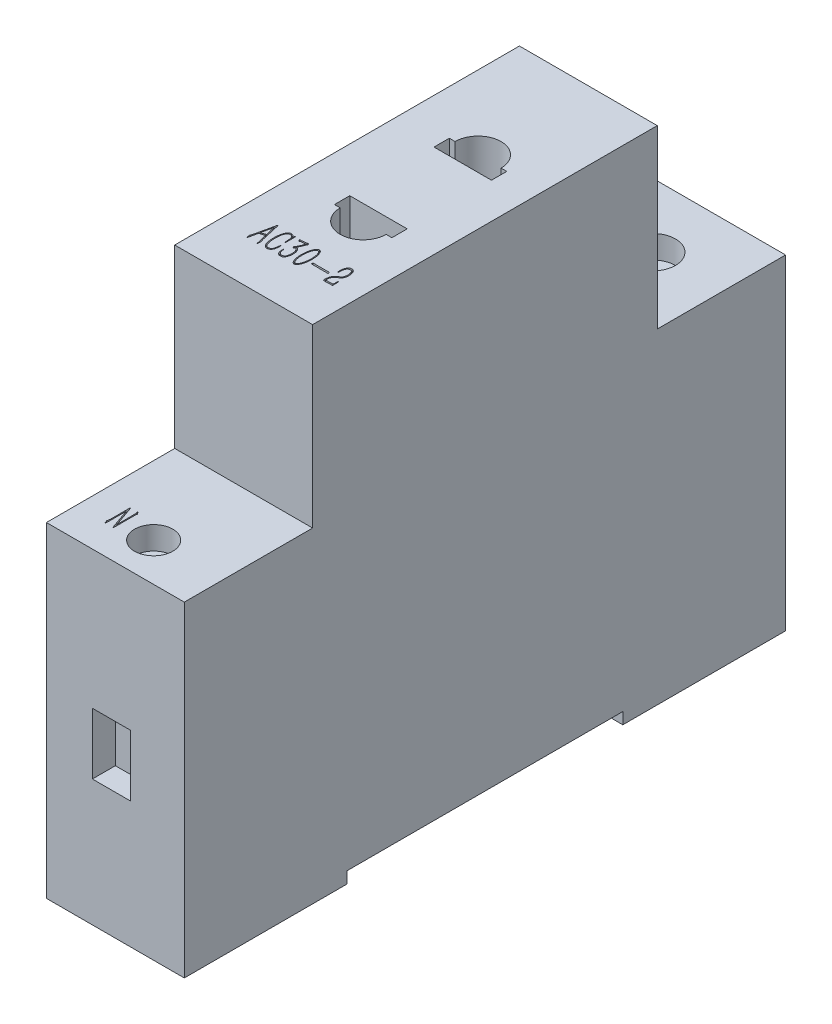
from build123d import *

# Parameters (mm, degrees)
EXTRUDE_1_DEPTH     = 9
SKETCH_2_R          = 2.5
CUT_EXTRUDE_1_DEPTH = 3
SKETCH_3_W          = 5
SKETCH_3_H          = 8
CUT_EXTRUDE_2_DEPTH = 3
SKETCH_5_R          = 3
CUT_EXTRUDE_3_DEPTH = 3
SKETCH_6_W          = 5
SKETCH_6_H          = 8
CUT_EXTRUDE_4_DEPTH = 3
SKETCH_9_W          = 2.164287236
SKETCH_9_H          = 0.217025357
CUT_EXTRUDE_6_DEPTH = 0.3
CUT_EXTRUDE_7_DEPTH = 0.3
CUT_EXTRUDE_9_DEPTH = 5


with BuildPart() as part:
    # 草图1 → 凸台-拉伸1 (new, symmetric)
    with BuildSketch(Plane(origin=(0, 0, 0), x_dir=(0, 0, -1), z_dir=(1, 0, 0))):
        Polygon((-22.5, 32.75), (-22.5, 9.75), (-39.25, 9.75), (-39.25, -32.75), (-22.5, -32.75), (-18, -32.75), (-18, -31.25), (18, -31.25), (18, -32.75), (22.5, -32.75), (39.25, -32.75), (39.25, 9.75), (22.5, 9.75), (22.5, 32.75), align=None)
    extrude(amount=EXTRUDE_1_DEPTH, both=True)

    # 草图2 → 切除-拉伸1 (cut)
    with BuildSketch(Plane(origin=(0, 9.75, 0), x_dir=(1, 0, 0), z_dir=(0, 1, 0))):
        with Locations((0, -34.25)):
            Circle(SKETCH_2_R)
    extrude(amount=-CUT_EXTRUDE_1_DEPTH, mode=Mode.SUBTRACT)

    # 草图3 → 切除-拉伸2 (cut)
    with BuildSketch(Plane.XY.offset(39.25)):
        with Locations((-0.5, -12.25)):
            Rectangle(SKETCH_3_W, SKETCH_3_H)
    extrude(amount=-CUT_EXTRUDE_2_DEPTH, mode=Mode.SUBTRACT)

    # 草图5 → 切除-拉伸3 (cut)
    with BuildSketch(Plane(origin=(0, 9.75, 0), x_dir=(1, 0, 0), z_dir=(0, 1, 0))):
        with Locations((0, 30.875)):
            Circle(SKETCH_5_R)
    extrude(amount=-CUT_EXTRUDE_3_DEPTH, mode=Mode.SUBTRACT)

    # 草图6 → 切除-拉伸4 (cut)
    with BuildSketch(Plane(origin=(0, 0, -39.25), x_dir=(-1, 0, 0), z_dir=(0, 0, -1))):
        with Locations((0.051136376, -12.435750671)):
            Rectangle(SKETCH_6_W, SKETCH_6_H)
    extrude(amount=-CUT_EXTRUDE_4_DEPTH, mode=Mode.SUBTRACT)

    # 草图9 → 切除-拉伸6 (cut)
    # profile 1 of 6: a face of its own
    with BuildSketch(Plane(origin=(0, 32.75, 0), x_dir=(1, 0, 0), z_dir=(0, 1, 0))):
        with BuildLine():
            Line((-4.153846154, -15.517259749), (-4.838482847, -15.682825485))
            Line((-4.838482847, -15.682825485), (-4.999573833, -16.433091839))
            Line((-4.999573833, -16.433091839), (-5.075644577, -16.815682932))
            Line((-5.075644577, -16.815682932), (-5.105476241, -16.936501172))
            add(Edge.make_bspline(
                [(-5.105476241, -16.936501172), (-5.10864397, -16.945059256), (-5.113986048, -16.959491663), (-5.124037779, -16.97647154), (-5.13506828, -16.98490966), (-5.14738396, -16.98668845), (-5.156623365, -16.976009255), (-5.162117538, -16.962475291), (-5.163762051, -16.942614008), (-5.168331734, -16.916755356), (-5.171189485, -16.879763732), (-5.174468618, -16.851712187), (-5.176326444, -16.835819305)],
                knots=[0, 0, 0, 0, 1.226577759, 2.068508672, 2.595953142, 3.064162245, 3.560072257, 4.322224954, 5.029865969, 6.20926766, 7.852322798, 10, 10, 10, 10], degree=3))
            Line((-5.176326444, -16.835819305), (-5.200937567, -16.624760281))
            add(Edge.make_bspline(
                [(-5.200937567, -16.624760281), (-5.202528405, -16.607368105), (-5.205366473, -16.576340333), (-5.207860132, -16.535289216), (-5.208022043, -16.505671284), (-5.206586828, -16.480893098), (-5.199249484, -16.457460972), (-5.190532766, -16.441402394), (-5.186021734, -16.433091839)],
                knots=[0, 0, 0, 0, 1.603576797, 2.86079302, 3.773774944, 4.323462854, 5.1323669, 6, 6, 6, 6], degree=3))
            Line((-5.186021734, -16.433091839), (-5.16066482, -16.387598551))
            add(Edge.make_bspline(
                [(-5.16066482, -16.387598551), (-5.155234051, -16.375749704), (-5.142264208, -16.347452114), (-5.125841933, -16.295357842), (-5.108345759, -16.227530288), (-5.090715847, -16.149461978), (-5.073434547, -16.073859556), (-5.059628871, -16.012257796), (-5.04903273, -15.971395967), (-5.042141348, -15.951292584), (-5.03984658, -15.944598338)],
                knots=[0, 0, 0, 0, 0.679694972, 1.623257572, 2.844174753, 4.335796169, 5.799225578, 6.891200865, 7.630779852, 8, 8, 8, 8], degree=3))
            Line((-5.03984658, -15.944598338), (-4.521521415, -13.543895163))
            Line((-4.521521415, -13.543895163), (-4.451417004, -13.543895163))
            Line((-4.451417004, -13.543895163), (-3.962923503, -15.702961858))
            Line((-3.962923503, -15.702961858), (-3.902514383, -15.95503942))
            add(Edge.make_bspline(
                [(-3.902514383, -15.95503942), (-3.896454785, -15.98341577), (-3.885584754, -16.034318782), (-3.869043657, -16.101920209), (-3.855477696, -16.152543791), (-3.845938582, -16.180301036), (-3.842105263, -16.191455359)],
                knots=[0, 0, 0, 0, 1.425899692, 2.557855139, 3.420470246, 4, 4, 4, 4], degree=3))
            Line((-3.842105263, -16.191455359), (-3.807053058, -16.286916684))
            add(Edge.make_bspline(
                [(-3.807053058, -16.286916684), (-3.803018292, -16.300900397), (-3.795667104, -16.326378181), (-3.783109763, -16.360097705), (-3.770768714, -16.386133792), (-3.755055502, -16.40806158), (-3.739116806, -16.42451921), (-3.728115071, -16.441586532), (-3.726725188, -16.457519374), (-3.728652254, -16.472125844), (-3.730710195, -16.490728918), (-3.731711538, -16.514153121), (-3.734369821, -16.546426333), (-3.735544096, -16.570809028), (-3.736202855, -16.584487535)],
                knots=[0, 0, 0, 0, 1.645080438, 2.997272953, 4.065812928, 4.892545225, 6.029861332, 6.67147811, 7.124734071, 7.80170629, 8.338742145, 9.240009017, 10.451666043, 12, 12, 12, 12], degree=3))
            Line((-3.736202855, -16.584487535), (-3.756339229, -16.810462391))
            Line((-3.756339229, -16.810462391), (-3.766780311, -16.896228425))
            add(Edge.make_bspline(
                [(-3.766780311, -16.896228425), (-3.767276735, -16.905954831), (-3.76815915, -16.923243947), (-3.772413177, -16.9455144), (-3.775198303, -16.961680016), (-3.781065911, -16.973375317), (-3.792213852, -16.979158277), (-3.806034167, -16.975124678), (-3.816656291, -16.96114578), (-3.820012176, -16.948875905), (-3.82196889, -16.941721713)],
                knots=[0, 0, 0, 0, 1.663187075, 2.956388731, 3.874273883, 4.464983498, 5.130530035, 5.83179128, 6.735783313, 8, 8, 8, 8], degree=3))
            Line((-3.82196889, -16.941721713), (-3.857021095, -16.74035798))
            Line((-3.857021095, -16.74035798), (-4.153846154, -15.517259749))
        make_face()
        with BuildLine():
            Line((-4.164287236, -15.441189005), (-4.486469209, -14.027168123))
            Line((-4.486469209, -14.027168123), (-4.813871724, -15.506818666))
            add(Edge.make_bspline(
                [(-4.813871724, -15.506818666), (-4.785469746, -15.502440871), (-4.736436445, -15.494883025), (-4.66809484, -15.479873252), (-4.603414001, -15.462106351), (-4.545976991, -15.446213948), (-4.498533158, -15.430091389), (-4.467534101, -15.419423278), (-4.443983916, -15.408400165), (-4.431457775, -15.400042808), (-4.426060089, -15.396441509)],
                knots=[0, 0, 0, 0, 1.70172219, 2.937860729, 4.141475294, 5.674569601, 6.46612829, 7.108957565, 7.616037637, 8, 8, 8, 8], degree=3))
            Line((-4.426060089, -15.396441509), (-4.300021308, -15.310675474))
            Line((-4.300021308, -15.310675474), (-4.164287236, -15.441189005))
        make_face(mode=Mode.SUBTRACT)
    # profile 2 of 6: a face of its own
    with BuildSketch(Plane(origin=(0, 32.75, 0), x_dir=(1, 0, 0), z_dir=(0, 1, 0))):
        with BuildLine():
            Line((-2.154378862, -13.95631792), (-2.118580865, -13.659492862))
            Line((-2.118580865, -13.659492862), (-2.043255913, -13.659492862))
            Line((-2.043255913, -13.659492862), (-2.043255913, -15.003409333))
            Line((-2.043255913, -15.003409333), (-2.138717238, -15.003409333))
            add(Edge.make_bspline(
                [(-2.138717238, -15.003409333), (-2.138847848, -14.979044476), (-2.139121111, -14.928068106), (-2.142037466, -14.846552828), (-2.143899059, -14.753560188), (-2.147067392, -14.648656873), (-2.150044643, -14.536336662), (-2.161034693, -14.421325542), (-2.177835803, -14.305088994), (-2.203475464, -14.188496192), (-2.237192223, -14.07606274), (-2.277029876, -13.990486403), (-2.314226621, -13.930399112), (-2.344696643, -13.891337922), (-2.378660136, -13.858056011), (-2.42726281, -13.821844688), (-2.493643297, -13.785362539), (-2.552385557, -13.775029591), (-2.581717452, -13.769870019)],
                knots=[0, 0, 0, 0, 0.822473136, 1.720785642, 2.753326599, 3.962261781, 5.264018637, 6.545024146, 7.860049611, 9.226346671, 10.572050264, 11.814683136, 12.399128484, 12.954850798, 13.483022901, 13.998303406, 15.000488703, 16, 16, 16, 16], degree=3))
            add(Edge.make_bspline(
                [(-2.581717452, -13.769870019), (-2.604143012, -13.769271775), (-2.648899814, -13.768077803), (-2.715441677, -13.78153376), (-2.7795427, -13.806647815), (-2.841041957, -13.843038343), (-2.899627026, -13.88980444), (-2.951586298, -13.949631437), (-3.000993572, -14.018313232), (-3.041970529, -14.098736511), (-3.078282205, -14.185169663), (-3.112059777, -14.275097553), (-3.138257563, -14.368823702), (-3.166595397, -14.496167199), (-3.191791887, -14.654143397), (-3.209894779, -14.838036678), (-3.219357046, -15.009759192), (-3.222687096, -15.169969078), (-3.219397926, -15.323937552), (-3.213932839, -15.425540075), (-3.211165566, -15.476987002)],
                knots=[0, 0, 0, 0, 0.603095173, 1.203653813, 1.814626149, 2.451293107, 3.123130818, 3.825388984, 4.580186105, 5.398460658, 6.251023789, 7.107448911, 7.985514538, 8.871470416, 10.622993602, 12.29317529, 13.850163291, 15.257553743, 16.61134915, 18, 18, 18, 18], degree=3))
            add(Edge.make_bspline(
                [(-3.211165566, -15.476987002), (-3.207141866, -15.522995358), (-3.198908502, -15.617138444), (-3.185205272, -15.736565277), (-3.169361046, -15.837660378), (-3.153651215, -15.920968012), (-3.134068867, -16.01118983), (-3.112097319, -16.104859171), (-3.087368362, -16.194473438), (-3.064149264, -16.273940978), (-3.0407446, -16.338840519), (-3.009948785, -16.405831128), (-2.966377041, -16.476136539), (-2.909774013, -16.551912506), (-2.846301728, -16.614607183), (-2.778252898, -16.662330049), (-2.702330352, -16.690068949), (-2.649313201, -16.693233701), (-2.621990198, -16.694864692)],
                knots=[0, 0, 0, 0, 1.515526627, 3.101096572, 3.943353373, 4.87293365, 5.882541642, 6.972773351, 8.029529644, 8.932786276, 9.68898916, 10.291221641, 11.348890653, 12.39638072, 13.388602443, 14.264213047, 15.105442077, 16, 16, 16, 16], degree=3))
            add(Edge.make_bspline(
                [(-2.621990198, -16.694864692), (-2.596527409, -16.695208185), (-2.544674824, -16.695907677), (-2.467443973, -16.676266369), (-2.39247369, -16.644890815), (-2.322446322, -16.598563452), (-2.260660198, -16.537059595), (-2.208112807, -16.460530153), (-2.166442554, -16.369383439), (-2.13764843, -16.265259683), (-2.114417756, -16.152922142), (-2.0993168, -16.057057999), (-2.088631024, -15.984603481), (-2.081716929, -15.941164633), (-2.077381182, -15.908790746), (-2.074836991, -15.891148616), (-2.073833369, -15.884189218)],
                knots=[0, 0, 0, 0, 0.974493461, 1.984464659, 3.032762083, 4.086915356, 5.187622472, 6.361151533, 7.634420725, 9.018373663, 10.501751059, 12.040324543, 12.745324753, 13.31527632, 13.729892907, 14, 14, 14, 14], degree=3))
            Line((-2.073833369, -15.884189218), (-2.048476454, -15.617941615))
            Line((-2.048476454, -15.617941615), (-1.967930961, -15.622416365))
            add(Edge.make_bspline(
                [(-1.967930961, -15.622416365), (-1.967830566, -15.647277054), (-1.96764784, -15.692525025), (-1.9687584, -15.754169806), (-1.968975964, -15.803166407), (-1.970973755, -15.843168215), (-1.97227045, -15.880744115), (-1.975535527, -15.922752306), (-1.979959326, -15.972728249), (-1.987927194, -16.04648763), (-1.995948906, -16.134889966), (-2.00717445, -16.233853206), (-2.023886367, -16.330548493), (-2.055245267, -16.431476186), (-2.09841565, -16.537427687), (-2.14717708, -16.621968331), (-2.193658318, -16.684516727), (-2.234338133, -16.726189058), (-2.279478025, -16.764207942), (-2.329787196, -16.79633569), (-2.382877233, -16.82334811), (-2.438190392, -16.842512316), (-2.494270908, -16.856907128), (-2.532657255, -16.859751443), (-2.551885787, -16.86117622)],
                knots=[0, 0, 0, 0, 1.082557886, 1.97032136, 2.684891572, 3.215786613, 3.714233695, 4.322010655, 5.050226996, 5.899051791, 7.552532718, 8.915438272, 10.236158893, 11.818471953, 13.507262255, 15.209909354, 16.052150521, 16.894322113, 17.739826851, 18.616631911, 19.488074199, 20.326969254, 21.161943562, 22, 22, 22, 22], degree=3))
            add(Edge.make_bspline(
                [(-2.551885787, -16.86117622), (-2.584050628, -16.862585178), (-2.649565549, -16.865455014), (-2.746210279, -16.843418682), (-2.836608298, -16.808503478), (-2.905440284, -16.768347901), (-2.954540688, -16.728515916), (-2.989551677, -16.691874136), (-3.024934462, -16.650134448), (-3.058813171, -16.601399335), (-3.092696464, -16.546904213), (-3.124262394, -16.485821366), (-3.154841922, -16.419016663), (-3.195779572, -16.320406991), (-3.239917752, -16.183864194), (-3.275126669, -16.038146746), (-3.298806336, -15.912130644), (-3.313059337, -15.809238509), (-3.326783779, -15.700396125), (-3.341312004, -15.548809972), (-3.353284604, -15.360340153), (-3.359405029, -15.137664793), (-3.35295544, -14.91702744), (-3.335595764, -14.770629558), (-3.326763264, -14.696143192)],
                knots=[0, 0, 0, 0, 0.828879423, 1.68830212, 2.536676829, 3.328986324, 3.73541648, 4.167069034, 4.63682846, 5.148487351, 5.699502401, 6.294435402, 6.924061178, 7.598240742, 9.053084533, 10.627089957, 11.470192478, 12.366164513, 13.311378798, 14.305576584, 16.301598498, 18.191207909, 20.062109376, 22, 22, 22, 22], degree=3))
            add(Edge.make_bspline(
                [(-3.326763264, -14.696143192), (-3.316684952, -14.621572919), (-3.296627654, -14.4731673), (-3.251872225, -14.293125126), (-3.209270715, -14.157641548), (-3.176168816, -14.067297649), (-3.141019476, -13.988695545), (-3.104984339, -13.920173424), (-3.066294568, -13.86049449), (-3.025616892, -13.80689251), (-2.980194445, -13.760843292), (-2.933968265, -13.719981273), (-2.88754957, -13.686636805), (-2.844886975, -13.658971495), (-2.807311696, -13.636621594), (-2.760656473, -13.617115821), (-2.699222561, -13.602097789), (-2.64868657, -13.603541579), (-2.621990198, -13.604304283)],
                knots=[0, 0, 0, 0, 2.546659555, 5.068220541, 6.268960188, 7.35572531, 8.324149365, 9.182807276, 9.974388089, 10.730435642, 11.456747585, 12.160764052, 12.817438768, 13.389505863, 13.883390408, 14.294592413, 15.099093679, 16, 16, 16, 16], degree=3))
            add(Edge.make_bspline(
                [(-2.621990198, -13.604304283), (-2.594691369, -13.608978906), (-2.538740769, -13.618559829), (-2.456921855, -13.64857607), (-2.376119375, -13.69001941), (-2.306179263, -13.74852705), (-2.244316757, -13.808975937), (-2.213427117, -13.854634298), (-2.199126358, -13.875772427)],
                knots=[0, 0, 0, 0, 0.959137923, 1.965811105, 3.01152559, 4.09188384, 5.116612916, 6, 6, 6, 6], degree=3))
            Line((-2.199126358, -13.875772427), (-2.154378862, -13.95631792))
        make_face()
    # profile 3 of 6: a face of its own
    with BuildSketch(Plane(origin=(0, 32.75, 0), x_dir=(1, 0, 0), z_dir=(0, 1, 0))):
        with BuildLine():
            add(Edge.make_bspline(
                [(-0.949179629, -14.832623056), (-0.938007995, -14.809496011), (-0.916487303, -14.764944784), (-0.885097354, -14.700591841), (-0.855813392, -14.641507765), (-0.830766768, -14.586681307), (-0.80741193, -14.537321203), (-0.786611422, -14.492899036), (-0.768638382, -14.453400283), (-0.749716567, -14.409548209), (-0.730091755, -14.36380032), (-0.711093289, -14.318991432), (-0.69727738, -14.286983409), (-0.690134527, -14.270050493), (-0.687406776, -14.263584061)],
                knots=[0, 0, 0, 0, 1.475873638, 2.843077615, 4.114458223, 5.26483622, 6.306479236, 7.252326145, 8.083448402, 8.799989154, 9.996708352, 10.943956596, 11.596712522, 12, 12, 12, 12], degree=3))
            Line((-0.687406776, -14.263584061), (-0.526315789, -13.83549968))
            add(Edge.make_bspline(
                [(-0.526315789, -13.83549968), (-0.561351946, -13.838928371), (-0.637799113, -13.846409606), (-0.73535917, -13.852349721), (-0.816476861, -13.856675542), (-0.872137467, -13.861339664), (-0.920877275, -13.865699087), (-0.950924265, -13.869015711), (-0.964841253, -13.870551886)],
                knots=[0, 0, 0, 0, 1.440114021, 3.142257811, 3.998086789, 4.76330671, 5.427195687, 6, 6, 6, 6], degree=3))
            Line((-0.964841253, -13.870551886), (-1.115491157, -13.8959088))
            add(Edge.make_bspline(
                [(-1.115491157, -13.8959088), (-1.122222602, -13.897323976), (-1.140587823, -13.901184961), (-1.174550787, -13.911728117), (-1.223463727, -13.924693766), (-1.260693143, -13.935356299), (-1.281802685, -13.941402088)],
                knots=[0, 0, 0, 0, 0.478461291, 1.305373098, 2.472113022, 4, 4, 4, 4], degree=3))
            Line((-1.281802685, -13.941402088), (-1.331770722, -13.961538462))
            Line((-1.331770722, -13.961538462), (-1.457809504, -13.77509056))
            add(Edge.make_bspline(
                [(-1.457809504, -13.77509056), (-1.463131701, -13.767790732), (-1.472217261, -13.755329146), (-1.479759894, -13.737993825), (-1.485358692, -13.72595056), (-1.480340656, -13.713822976), (-1.460497867, -13.715641528), (-1.44551626, -13.726278227), (-1.42638056, -13.736512097), (-1.404364508, -13.737951427), (-1.377673257, -13.739517838), (-1.358110909, -13.73647747), (-1.347432346, -13.734817814)],
                knots=[0, 0, 0, 0, 1.323589942, 2.259509366, 2.829398404, 3.190947808, 3.965341466, 5.19662492, 6.050472624, 7.088782, 8.410843841, 10, 10, 10, 10], degree=3))
            Line((-1.347432346, -13.734817814), (-1.186341359, -13.729597273))
            Line((-1.186341359, -13.729597273), (-0.551672704, -13.65427232))
            Line((-0.551672704, -13.65427232), (-0.501704667, -13.608779033))
            Line((-0.501704667, -13.608779033), (-0.46143192, -13.568506286))
            add(Edge.make_bspline(
                [(-0.46143192, -13.568506286), (-0.460182944, -13.569993019), (-0.455062836, -13.576087798), (-0.444040159, -13.590590628), (-0.424440297, -13.613891368), (-0.409621929, -13.633308961), (-0.4010228, -13.64457703)],
                knots=[0, 0, 0, 0, 0.23984028, 0.983211964, 2.249351781, 4, 4, 4, 4], degree=3))
            Line((-0.4010228, -13.64457703), (-0.304815683, -13.76539527))
            add(Edge.make_bspline(
                [(-0.304815683, -13.76539527), (-0.298355223, -13.773783312), (-0.287618963, -13.787722909), (-0.279653937, -13.810016338), (-0.287815652, -13.82512065), (-0.299217075, -13.838067786), (-0.317698844, -13.853618288), (-0.332342046, -13.864439317), (-0.34061368, -13.870551886)],
                knots=[0, 0, 0, 0, 1.419029252, 2.358201718, 2.827787952, 3.596253847, 4.642174893, 6, 6, 6, 6], degree=3))
            Line((-0.34061368, -13.870551886), (-0.395802259, -13.916045174))
            add(Edge.make_bspline(
                [(-0.395802259, -13.916045174), (-0.411930793, -13.956578471), (-0.442532423, -14.033484713), (-0.486623308, -14.142935579), (-0.526968269, -14.240253133), (-0.56239394, -14.326287286), (-0.594932917, -14.400060178), (-0.621795766, -14.462658281), (-0.645981072, -14.512879656), (-0.660774072, -14.542278227), (-0.667270403, -14.555188579)],
                knots=[0, 0, 0, 0, 1.507300768, 2.859891598, 4.076963614, 5.147345159, 6.074452096, 6.862861548, 7.500626815, 8, 8, 8, 8], degree=3))
            Line((-0.667270403, -14.555188579), (-0.818666098, -14.842318346))
            add(Edge.make_bspline(
                [(-0.818666098, -14.842318346), (-0.80077064, -14.8408895), (-0.76649768, -14.838153008), (-0.71419291, -14.832929177), (-0.657203857, -14.84011451), (-0.607219528, -14.860105118), (-0.564691589, -14.884771996), (-0.530613943, -14.909409359), (-0.498057892, -14.941431036), (-0.464860727, -14.979074857), (-0.431586015, -15.024004711), (-0.400998082, -15.078423989), (-0.369156435, -15.140565939), (-0.329334787, -15.235269274), (-0.2863058, -15.361984268), (-0.260162087, -15.52113901), (-0.247245092, -15.680595693), (-0.245348784, -15.786714377), (-0.244406563, -15.839441722)],
                knots=[0, 0, 0, 0, 0.660541429, 1.265053373, 1.928435853, 2.750244091, 3.225390118, 3.735570922, 4.291687282, 4.900607759, 5.580848831, 6.342918567, 7.193367346, 8.147740655, 10.119512469, 12.097611575, 14.061014616, 16, 16, 16, 16], degree=3))
            add(Edge.make_bspline(
                [(-0.244406563, -15.839441722), (-0.246396925, -15.880721601), (-0.250177974, -15.959140118), (-0.259315874, -16.069951499), (-0.272952287, -16.167167426), (-0.292811388, -16.276769954), (-0.327834368, -16.397859178), (-0.371100816, -16.509575171), (-0.412181655, -16.590060186), (-0.44680367, -16.643429303), (-0.484724653, -16.6911748), (-0.525475694, -16.732957284), (-0.567865185, -16.767293719), (-0.609006124, -16.796824178), (-0.650636578, -16.817695346), (-0.704530928, -16.835131144), (-0.770391111, -16.847149747), (-0.822845914, -16.849557621), (-0.848497763, -16.850735137)],
                knots=[0, 0, 0, 0, 1.512752116, 2.8737433, 4.067977017, 5.104892351, 6.948544146, 8.672095895, 9.482011449, 10.251829035, 10.996496654, 11.710742831, 12.38300564, 12.991319199, 13.561044299, 14.079002633, 15.060579187, 16, 16, 16, 16], degree=3))
            add(Edge.make_bspline(
                [(-0.848497763, -16.850735137), (-0.870377698, -16.851108091), (-0.912472183, -16.85182561), (-0.973529129, -16.846855109), (-1.029138583, -16.83547854), (-1.081291016, -16.820002461), (-1.13013346, -16.795528833), (-1.17678744, -16.760568347), (-1.22375304, -16.717518531), (-1.26878365, -16.664688541), (-1.309996278, -16.604162867), (-1.346031514, -16.537213204), (-1.375971834, -16.464787362), (-1.405736289, -16.361715429), (-1.430964188, -16.229916753), (-1.435458607, -16.123212995), (-1.43767313, -16.070637119)],
                knots=[0, 0, 0, 0, 0.828828519, 1.594571005, 2.314948186, 2.97625877, 3.650192192, 4.371738268, 5.178272596, 6.059897072, 6.995131469, 7.947518938, 8.935744196, 9.957858231, 12.008325587, 14, 14, 14, 14], degree=3))
            Line((-1.43767313, -16.070637119), (-1.442893671, -15.874493927))
            Line((-1.442893671, -15.874493927), (-1.387705093, -15.874493927))
            add(Edge.make_bspline(
                [(-1.387705093, -15.874493927), (-1.383484895, -15.903580402), (-1.375402843, -15.959283581), (-1.363646568, -16.039649112), (-1.351470256, -16.112907738), (-1.337747893, -16.199602325), (-1.314893736, -16.296950996), (-1.276391451, -16.401723578), (-1.224176959, -16.4902498), (-1.162870717, -16.563201481), (-1.091169414, -16.616153574), (-1.014411982, -16.649554655), (-0.936182303, -16.665325211), (-0.884350078, -16.665129149), (-0.858938845, -16.665033028)],
                knots=[0, 0, 0, 0, 0.994021113, 1.903638599, 2.746793397, 3.505624798, 4.871908371, 6.122639036, 7.264652637, 8.331625701, 9.323760524, 10.250011688, 11.142051883, 12, 12, 12, 12], degree=3))
            add(Edge.make_bspline(
                [(-0.858938845, -16.665033028), (-0.83849589, -16.663270178), (-0.798456646, -16.659817489), (-0.740395396, -16.646672736), (-0.686700419, -16.624243739), (-0.636506286, -16.595561937), (-0.59132656, -16.558159879), (-0.550664563, -16.514088042), (-0.516229052, -16.461731756), (-0.477636545, -16.381577308), (-0.440130551, -16.271073813), (-0.41191027, -16.130715034), (-0.393546871, -15.987545354), (-0.384919846, -15.845092224), (-0.383744369, -15.704751157), (-0.395284256, -15.612902298), (-0.4010228, -15.567227786)],
                knots=[0, 0, 0, 0, 0.647840119, 1.268849254, 1.871153999, 2.479976942, 3.088343857, 3.716462885, 4.367721208, 5.059616847, 6.52246665, 8.039623249, 9.575767262, 11.078710543, 12.547304005, 14, 14, 14, 14], degree=3))
            add(Edge.make_bspline(
                [(-0.4010228, -15.567227786), (-0.409046982, -15.517997394), (-0.424908942, -15.420680239), (-0.461600718, -15.303871136), (-0.497731885, -15.216647063), (-0.529967159, -15.158126652), (-0.566504434, -15.105854079), (-0.60789187, -15.0620123), (-0.649847121, -15.02603529), (-0.691959003, -15.002028728), (-0.733546708, -14.989675469), (-0.76019516, -14.992391399), (-0.773172811, -14.993714042)],
                knots=[0, 0, 0, 0, 2.019199264, 3.991492233, 4.943861116, 5.841091039, 6.693606335, 7.520378909, 8.278781735, 8.923571305, 9.475785111, 10, 10, 10, 10], degree=3))
            Line((-0.773172811, -14.993714042), (-0.853718304, -15.003409333))
            Line((-0.853718304, -15.003409333), (-0.888770509, -15.069038994))
            add(Edge.make_bspline(
                [(-0.888770509, -15.069038994), (-0.893449035, -15.077218085), (-0.901604853, -15.091476247), (-0.912749691, -15.110322325), (-0.921650935, -15.121360908), (-0.928407181, -15.130876976), (-0.938173896, -15.127675758), (-0.944455865, -15.116736788), (-0.95449817, -15.100633091), (-0.961030596, -15.086802366), (-0.964841253, -15.078734285)],
                knots=[0, 0, 0, 0, 1.659028505, 2.892093886, 3.763458346, 4.288089223, 4.647361994, 5.327919393, 6.441255868, 8, 8, 8, 8], degree=3))
            Line((-0.964841253, -15.078734285), (-1.045386746, -14.92286384))
            add(Edge.make_bspline(
                [(-1.045386746, -14.92286384), (-1.051208731, -14.913905413), (-1.061358111, -14.89828832), (-1.05695808, -14.880486129), (-1.055082037, -14.872895802)],
                knots=[0, 0, 0, 0, 1.147259222, 2, 2, 2, 2], degree=3))
            Line((-1.055082037, -14.872895802), (-1.01480929, -14.857234179))
            Line((-1.01480929, -14.857234179), (-0.949179629, -14.832623056))
        make_face()
    # profile 4 of 6: a face of its own
    with BuildSketch(Plane(origin=(0, 32.75, 0), x_dir=(1, 0, 0), z_dir=(0, 1, 0))):
        with BuildLine():
            add(Edge.make_bspline(
                [(0.345514596, -15.179416152), (0.347944988, -15.131169164), (0.352924404, -15.032320124), (0.366460888, -14.880807899), (0.386427644, -14.722745507), (0.409581468, -14.560418531), (0.441620123, -14.400062182), (0.482623602, -14.247564625), (0.534967818, -14.106567459), (0.587199156, -13.998299694), (0.631353156, -13.918919111), (0.663479407, -13.866113237), (0.69404306, -13.818491335), (0.724155273, -13.777116713), (0.753710507, -13.741885261), (0.780967933, -13.711336604), (0.808476725, -13.687553006), (0.842976733, -13.663969388), (0.884970678, -13.642935301), (0.933633804, -13.624534304), (0.980458372, -13.613889912), (1.01096227, -13.613963889), (1.02567654, -13.613999574)],
                knots=[0, 0, 0, 0, 1.583211401, 3.243703523, 4.983978234, 6.804605119, 8.6166428, 10.340282122, 11.974804003, 13.53820457, 14.274983449, 14.951299633, 15.563740824, 16.129235462, 16.626851747, 17.070813204, 17.469389546, 17.815167281, 18.438300608, 19.002855301, 19.519003895, 20, 20, 20, 20], degree=3))
            add(Edge.make_bspline(
                [(1.02567654, -13.613999574), (1.039746726, -13.616459908), (1.069465149, -13.621656516), (1.113401106, -13.640978515), (1.160032796, -13.666674607), (1.209646473, -13.699979022), (1.259181009, -13.744758612), (1.305087702, -13.804067884), (1.347706342, -13.876501231), (1.400668945, -13.991138172), (1.45903194, -14.146520746), (1.504858274, -14.309670215), (1.534625633, -14.445892431), (1.554038713, -14.554575747), (1.56947522, -14.669823427), (1.586051579, -14.831839255), (1.600834645, -15.039446829), (1.603217223, -15.206733422), (1.604410825, -15.290539101)],
                knots=[0, 0, 0, 0, 0.36369769, 0.768186139, 1.217229854, 1.724510149, 2.290946358, 2.914777825, 3.632489608, 4.433551378, 6.137860108, 7.866765886, 8.757390638, 9.699141408, 10.686159515, 11.726895222, 13.859299765, 16, 16, 16, 16], degree=3))
            add(Edge.make_bspline(
                [(1.604410825, -15.290539101), (1.599845282, -15.357691673), (1.59046214, -15.495704217), (1.568140184, -15.70707598), (1.531325163, -15.926967987), (1.484998126, -16.112195287), (1.440188355, -16.259675847), (1.402188118, -16.366096437), (1.359670049, -16.46659545), (1.314290052, -16.560198932), (1.267080697, -16.643523155), (1.218211885, -16.713539633), (1.166572355, -16.767466406), (1.113519513, -16.806202039), (1.061720225, -16.832452611), (1.012226258, -16.849236861), (0.965092977, -16.858553366), (0.934469933, -16.856798046), (0.919774132, -16.855955679)],
                knots=[0, 0, 0, 0, 1.760488992, 3.618172134, 5.557361062, 7.587083219, 8.607294374, 9.588398617, 10.541277716, 11.460251193, 12.307925722, 13.044175775, 13.687957546, 14.251129358, 14.754223989, 15.200440537, 15.616296545, 16, 16, 16, 16], degree=3))
            add(Edge.make_bspline(
                [(0.919774132, -16.855955679), (0.905731884, -16.853981824), (0.876145951, -16.849823063), (0.831549569, -16.83232251), (0.785108342, -16.80535887), (0.735529137, -16.769815252), (0.685605617, -16.720983648), (0.63753221, -16.657823334), (0.591430456, -16.579991114), (0.547618521, -16.488971783), (0.506468429, -16.387591742), (0.470436335, -16.278201112), (0.437053317, -16.163249762), (0.410304528, -16.043062084), (0.388293105, -15.921593071), (0.371022535, -15.802194541), (0.358904466, -15.686263306), (0.35236466, -15.574261754), (0.350077861, -15.467046052), (0.34766104, -15.365622522), (0.346149103, -15.270406715), (0.345720891, -15.208999618), (0.345514596, -15.179416152)],
                knots=[0, 0, 0, 0, 0.451175502, 0.950591959, 1.515271951, 2.162531354, 2.891688268, 3.734081857, 4.687580886, 5.773002708, 6.954198864, 8.17563603, 9.445923076, 10.771603705, 12.101713585, 13.383756751, 14.619631726, 15.819374781, 16.961914306, 18.040825747, 19.056148764, 20, 20, 20, 20], degree=3))
        make_face()
        with BuildLine():
            add(Edge.make_bspline(
                [(0.476773919, -15.189857234), (0.476243174, -15.213970051), (0.475116126, -15.265174096), (0.474044268, -15.346727177), (0.476043892, -15.437473764), (0.479460589, -15.571384315), (0.492004605, -15.7463886), (0.524064822, -15.956489317), (0.569852947, -16.159955169), (0.620307324, -16.319394452), (0.667279961, -16.433052669), (0.703324753, -16.503593055), (0.741245177, -16.560580067), (0.780974294, -16.603987537), (0.821161284, -16.634749719), (0.858717512, -16.656731719), (0.894306709, -16.671826187), (0.918158026, -16.67379474), (0.929469423, -16.674728319)],
                knots=[0, 0, 0, 0, 0.705717407, 1.498604912, 2.386138873, 3.361274458, 5.418191474, 7.514713171, 9.57394393, 11.515405308, 12.398906158, 13.169972934, 13.829695216, 14.395845116, 14.883250105, 15.303691084, 15.669778158, 16, 16, 16, 16], degree=3))
            add(Edge.make_bspline(
                [(0.929469423, -16.674728319), (0.939941235, -16.674593632), (0.962434549, -16.674304325), (0.997626392, -16.665841293), (1.034623365, -16.648026329), (1.075661317, -16.624615909), (1.117820565, -16.588586643), (1.159432495, -16.539348545), (1.200218461, -16.476244239), (1.240894831, -16.401625402), (1.279371725, -16.318607591), (1.313838926, -16.230653163), (1.343834627, -16.139859638), (1.376275234, -16.012833355), (1.409625741, -15.848085172), (1.439582119, -15.646900728), (1.459448184, -15.448504119), (1.467721354, -15.286650429), (1.470022634, -15.158533951), (1.468110136, -15.056584149), (1.464501776, -14.947181255), (1.460370169, -14.87164639), (1.45823567, -14.832623056)],
                knots=[0, 0, 0, 0, 0.308126263, 0.661851094, 1.055455993, 1.515432549, 2.051181639, 2.679899785, 3.409545513, 4.262246801, 5.183512362, 6.104777924, 7.045624675, 8.000099589, 9.967578284, 11.997814557, 13.993544283, 15.842664909, 16.77344086, 17.770161498, 18.848005724, 20, 20, 20, 20], degree=3))
            add(Edge.make_bspline(
                [(1.45823567, -14.832623056), (1.454638849, -14.796066133), (1.447657471, -14.725109673), (1.435383684, -14.622560938), (1.420153239, -14.527386101), (1.398692427, -14.410132694), (1.364049049, -14.269440377), (1.316330244, -14.135497041), (1.27517333, -14.034368551), (1.239797789, -13.970294107), (1.203818071, -13.91591731), (1.163835555, -13.87442096), (1.124917131, -13.842084379), (1.08828763, -13.81791592), (1.054075548, -13.800851831), (1.031037348, -13.796997303), (1.020455998, -13.795226934)],
                knots=[0, 0, 0, 0, 1.302834758, 2.528783491, 3.662347304, 4.720685654, 6.75648594, 8.792057095, 9.759925264, 10.624039914, 11.384659521, 12.06448684, 12.659424566, 13.175428451, 13.621277708, 14, 14, 14, 14], degree=3))
            add(Edge.make_bspline(
                [(1.020455998, -13.795226934), (1.008953528, -13.796063955), (0.984782746, -13.797822835), (0.947883854, -13.809133002), (0.908720236, -13.826818368), (0.865693595, -13.851350039), (0.820872146, -13.890723067), (0.775614453, -13.948357042), (0.72878452, -14.024804688), (0.679906606, -14.118911664), (0.633205046, -14.229788324), (0.593526012, -14.356787568), (0.559238098, -14.497760912), (0.533411599, -14.64873376), (0.512548961, -14.79983307), (0.496281945, -14.941858302), (0.48381986, -15.07038295), (0.479032705, -15.151556186), (0.476773919, -15.189857234)],
                knots=[0, 0, 0, 0, 0.347392606, 0.729995465, 1.156884588, 1.644891073, 2.219813456, 2.945627096, 3.849684979, 4.924243867, 6.145708801, 7.477723151, 8.938118981, 10.524254447, 12.100980159, 13.544449593, 14.841364989, 16, 16, 16, 16], degree=3))
        make_face(mode=Mode.SUBTRACT)
    # profile 5 of 6: a face of its own
    with BuildSketch(Plane(origin=(0, 32.75, 0), x_dir=(1, 0, 0), z_dir=(0, 1, 0))):
        with Locations((3.13626678, -15.610110804)):
            Rectangle(SKETCH_9_W, SKETCH_9_H)
    # profile 6 of 6: a face of its own
    with BuildSketch(Plane(origin=(0, 32.75, 0), x_dir=(1, 0, 0), z_dir=(0, 1, 0))):
        with BuildLine():
            Line((4.765075645, -14.907948008), (4.689004901, -14.907948008))
            add(Edge.make_bspline(
                [(4.689004901, -14.907948008), (4.687437497, -14.883838753), (4.684449365, -14.837876367), (4.681366022, -14.772237092), (4.68006391, -14.713301049), (4.678759494, -14.641451106), (4.680771233, -14.550839246), (4.68617292, -14.477854897), (4.689004901, -14.43959088)],
                knots=[0, 0, 0, 0, 0.927540379, 1.768282303, 2.522502339, 3.190652681, 4.527123766, 6, 6, 6, 6], degree=3))
            add(Edge.make_bspline(
                [(4.689004901, -14.43959088), (4.690964808, -14.411224602), (4.694755045, -14.356367473), (4.704758048, -14.277304967), (4.716334555, -14.204040591), (4.731385111, -14.135130037), (4.75172089, -14.067694177), (4.780671073, -13.999865322), (4.816777405, -13.929320257), (4.859436077, -13.858528312), (4.906242714, -13.791730429), (4.958781222, -13.737373181), (5.013767043, -13.695941984), (5.07227065, -13.671284108), (5.128442588, -13.655950426), (5.179666794, -13.643888852), (5.225698374, -13.635459442), (5.254781104, -13.634559842), (5.268484978, -13.634135947)],
                knots=[0, 0, 0, 0, 1.238521709, 2.395159043, 3.470603583, 4.46912877, 5.466066804, 6.534123646, 7.677244524, 8.916145015, 10.13365226, 11.221244199, 12.198275335, 13.109907183, 13.966820176, 14.733954848, 15.403435577, 16, 16, 16, 16], degree=3))
            add(Edge.make_bspline(
                [(5.268484978, -13.634135947), (5.285949173, -13.635423629), (5.320457883, -13.637968049), (5.371219239, -13.649757044), (5.42024429, -13.666755014), (5.482948985, -13.697035035), (5.556272032, -13.744509932), (5.618650411, -13.806852335), (5.661814478, -13.863918652), (5.692219331, -13.9124865), (5.719162828, -13.966719255), (5.752998931, -14.045521293), (5.7883962, -14.150092316), (5.813922902, -14.282166242), (5.830289993, -14.419319135), (5.837778459, -14.559530696), (5.839170859, -14.698360313), (5.831019126, -14.788902738), (5.827082889, -14.832623056)],
                knots=[0, 0, 0, 0, 0.570779476, 1.127842599, 1.694919432, 2.261066821, 3.397481896, 4.527710891, 5.118384485, 5.730727279, 6.394748858, 7.092559246, 8.529363642, 9.986910621, 11.474321506, 13.03467297, 14.568129345, 16, 16, 16, 16], degree=3))
            add(Edge.make_bspline(
                [(5.827082889, -14.832623056), (5.819103515, -14.877595303), (5.803025712, -14.968210792), (5.768396026, -15.077310591), (5.736099918, -15.160254554), (5.709098676, -15.215835458), (5.680248116, -15.265040046), (5.63853038, -15.323229347), (5.574821946, -15.389280707), (5.515785688, -15.433575514), (5.484764543, -15.456850629)],
                knots=[0, 0, 0, 0, 1.490916612, 3.004077927, 3.729534125, 4.397912905, 5.020560084, 5.590839424, 6.734084393, 8, 8, 8, 8], degree=3))
            Line((5.484764543, -15.456850629), (5.237907522, -15.612721074))
            add(Edge.make_bspline(
                [(5.237907522, -15.612721074), (5.206450518, -15.634076839), (5.146802034, -15.674571444), (5.067154842, -15.740717478), (5.000304341, -15.810413562), (4.949775247, -15.88747681), (4.910530335, -15.966802609), (4.875682103, -16.046453466), (4.849373459, -16.134247043), (4.830661729, -16.212938897), (4.817900948, -16.279028216), (4.811508817, -16.325120317), (4.806316076, -16.36585708), (4.805657463, -16.391313899), (4.805348391, -16.403260175)],
                knots=[0, 0, 0, 0, 1.453572249, 2.75625039, 3.953730064, 5.132566341, 6.263730064, 7.337486329, 8.453238547, 9.76321854, 10.430854957, 11.026567013, 11.543191201, 12, 12, 12, 12], degree=3))
            Line((4.805348391, -16.403260175), (4.794907309, -16.614319199))
            Line((4.794907309, -16.614319199), (5.695823567, -16.584487535))
            add(Edge.make_bspline(
                [(5.695823567, -16.584487535), (5.707383845, -16.58384117), (5.727688286, -16.582705897), (5.7472021, -16.561432511), (5.75154565, -16.53545769), (5.759253008, -16.503509408), (5.764982901, -16.457714397), (5.769403113, -16.422888043), (5.771894311, -16.403260175)],
                knots=[0, 0, 0, 0, 0.925905201, 1.626257371, 2.181371879, 3.087088273, 4.358305093, 6, 6, 6, 6], degree=3))
            Line((5.771894311, -16.403260175), (5.792030684, -15.964734711))
            Line((5.792030684, -15.964734711), (5.862135095, -15.964734711))
            Line((5.862135095, -15.964734711), (5.887492009, -16.629235031))
            add(Edge.make_bspline(
                [(5.887492009, -16.629235031), (5.888339705, -16.642153641), (5.889822325, -16.664748304), (5.890544044, -16.694637777), (5.890564472, -16.7154503), (5.890249703, -16.7322543), (5.884837513, -16.746946355), (5.8798085, -16.763993974), (5.860190792, -16.773625075), (5.83199173, -16.776706604), (5.789135425, -16.78107088), (5.755499576, -16.780791748), (5.736096314, -16.780630727)],
                knots=[0, 0, 0, 0, 1.385018147, 2.4223982, 3.193529914, 3.619812046, 4.200562765, 4.878496499, 5.402948042, 6.404258339, 7.925751149, 10, 10, 10, 10], degree=3))
            Line((5.736096314, -16.780630727), (4.734498189, -16.805987641))
            add(Edge.make_bspline(
                [(4.734498189, -16.805987641), (4.72232275, -16.80602326), (4.69832406, -16.806093467), (4.673731066, -16.782229493), (4.663407434, -16.753015349), (4.658240497, -16.718653654), (4.65477956, -16.673067061), (4.653117139, -16.594660922), (4.656671342, -16.483101036), (4.664677082, -16.391046611), (4.668868528, -16.342851055)],
                knots=[0, 0, 0, 0, 0.556373901, 1.096654043, 1.476064089, 2.012759395, 2.73145082, 3.635924119, 5.715166189, 8, 8, 8, 8], degree=3))
            add(Edge.make_bspline(
                [(4.668868528, -16.342851055), (4.672588087, -16.314719373), (4.679753251, -16.26052799), (4.694321706, -16.182522261), (4.709854042, -16.110115482), (4.726710725, -16.043351459), (4.745319674, -15.982581921), (4.76563129, -15.927876439), (4.786687411, -15.878353955), (4.818314796, -15.822331066), (4.85851074, -15.761264231), (4.90423142, -15.695419482), (4.94825153, -15.639565453), (5.005787959, -15.578117018), (5.083681269, -15.51104544), (5.149116604, -15.461933968), (5.182718943, -15.436714255)],
                knots=[0, 0, 0, 0, 1.103491021, 2.125706759, 3.085324024, 3.98349739, 4.803138144, 5.555704107, 6.252741852, 6.89323317, 8.054555834, 9.09539633, 10.010480884, 10.817709087, 12.365830683, 14, 14, 14, 14], degree=3))
            Line((5.182718943, -15.436714255), (5.389303218, -15.305454933))
            add(Edge.make_bspline(
                [(5.389303218, -15.305454933), (5.405842499, -15.294458614), (5.437581177, -15.273356812), (5.481419032, -15.239761031), (5.518792447, -15.204903019), (5.550999639, -15.167286672), (5.580155193, -15.123759224), (5.604099503, -15.069502942), (5.629412981, -15.005594266), (5.658927091, -14.906164307), (5.689358271, -14.774925503), (5.701023887, -14.612774792), (5.69479201, -14.448521197), (5.675739986, -14.339501183), (5.665991903, -14.283720435)],
                knots=[0, 0, 0, 0, 0.635613896, 1.219735276, 1.765761318, 2.268061313, 2.802129131, 3.435697723, 4.161225462, 5.001884758, 6.75303811, 8.46119913, 10.189351173, 12, 12, 12, 12], degree=3))
            add(Edge.make_bspline(
                [(5.665991903, -14.283720435), (5.658646557, -14.255283434), (5.644320693, -14.19982184), (5.617205953, -14.119927252), (5.582107583, -14.047161181), (5.544540067, -13.979186497), (5.497475069, -13.919685162), (5.434783784, -13.876951368), (5.360722536, -13.848384813), (5.306548601, -13.843354407), (5.278180268, -13.840720222)],
                knots=[0, 0, 0, 0, 1.101106684, 2.147523679, 3.156537618, 4.125318695, 5.058520457, 5.968677808, 6.93629249, 8, 8, 8, 8], degree=3))
            add(Edge.make_bspline(
                [(5.278180268, -13.840720222), (5.263247872, -13.840567345), (5.233464162, -13.840262422), (5.18910264, -13.846989724), (5.145954948, -13.861095041), (5.089276531, -13.886660148), (5.023783482, -13.934281022), (4.95484712, -14.006131897), (4.897985583, -14.093863379), (4.854206555, -14.195528165), (4.821287985, -14.311352071), (4.794564551, -14.441159204), (4.777017174, -14.586595675), (4.772114736, -14.688390276), (4.769550394, -14.74163648)],
                knots=[0, 0, 0, 0, 0.469335518, 0.936122588, 1.403629858, 1.893624907, 2.887406355, 3.927357629, 5.011993806, 6.157121359, 7.396943717, 8.794309501, 10.323183677, 12, 12, 12, 12], degree=3))
            Line((4.769550394, -14.74163648), (4.765075645, -14.907948008))
        make_face()
    extrude(amount=-CUT_EXTRUDE_6_DEPTH, mode=Mode.SUBTRACT)

    # 草图13 → 切除-拉伸7 (cut)
    with BuildSketch(Plane(origin=(0, 9.75, 0), x_dir=(1, 0, 0), z_dir=(0, 1, 0))):
        with BuildLine():
            Line((-4.239612188, -32.155444279), (-4.1941189, -32.109950991))
            Line((-4.1941189, -32.109950991), (-3.977839335, -32.376944385))
            add(Edge.make_bspline(
                [(-3.977839335, -32.376944385), (-3.982551934, -32.393188291), (-3.991669565, -32.424615947), (-4.006826912, -32.463009803), (-4.015825379, -32.496301484), (-4.021765684, -32.526695438), (-4.026765873, -32.563059596), (-4.032287853, -32.615989381), (-4.036045471, -32.67695356), (-4.037585486, -32.723734758), (-4.038248455, -32.743873855)],
                knots=[0, 0, 0, 0, 1.084494799, 2.098210167, 2.643672211, 3.294173657, 4.083496456, 4.997481927, 6.707429351, 8, 8, 8, 8], degree=3))
            Line((-4.038248455, -32.743873855), (-4.038248455, -35.467504794))
            Line((-4.038248455, -35.467504794), (-4.113573407, -35.467504794))
            Line((-4.113573407, -35.467504794), (-5.059982953, -32.769230769))
            Line((-5.059982953, -32.769230769), (-5.059982953, -35.059556787))
            add(Edge.make_bspline(
                [(-5.059982953, -35.059556787), (-5.060216021, -35.078449468), (-5.060712872, -35.118724639), (-5.061846198, -35.183158158), (-5.066138266, -35.254933388), (-5.070255229, -35.32991266), (-5.0743105, -35.397705267), (-5.08088149, -35.45125619), (-5.084698111, -35.481942214), (-5.094826119, -35.504488444), (-5.115559094, -35.495829588), (-5.131882151, -35.477737982), (-5.149980713, -35.442935743), (-5.159942858, -35.414413901), (-5.165885361, -35.397400384)],
                knots=[0, 0, 0, 0, 1.182286761, 2.52038347, 4.031227312, 5.682702803, 7.210982332, 8.306924227, 8.990285397, 9.270708198, 9.606495757, 10.101576878, 10.867574663, 12, 12, 12, 12], degree=3))
            Line((-5.165885361, -35.397400384), (-5.246430854, -35.170679736))
            add(Edge.make_bspline(
                [(-5.246430854, -35.170679736), (-5.251698143, -35.156219894), (-5.260559725, -35.13189294), (-5.266542164, -35.095108869), (-5.257244577, -35.059449964), (-5.247668375, -35.025099036), (-5.238208793, -34.988574575), (-5.230018677, -34.952070421), (-5.221928605, -34.90801735), (-5.213980191, -34.85651712), (-5.204971106, -34.797771494), (-5.200791752, -34.731692063), (-5.19633898, -34.658876358), (-5.196420228, -34.608113658), (-5.196462817, -34.581504368)],
                knots=[0, 0, 0, 0, 0.927779361, 1.560877733, 2.200839638, 3.115853294, 3.718492711, 4.470182357, 5.368516448, 6.414355644, 7.608241643, 8.944514625, 10.398345751, 12, 12, 12, 12], degree=3))
            Line((-5.196462817, -34.581504368), (-5.196462817, -32.145003196))
            Line((-5.196462817, -32.145003196), (-5.120392073, -32.145003196))
            Line((-5.120392073, -32.145003196), (-4.173982527, -34.853718304))
            Line((-4.173982527, -34.853718304), (-4.173982527, -32.749094396))
            add(Edge.make_bspline(
                [(-4.173982527, -32.749094396), (-4.174430241, -32.707818619), (-4.175312648, -32.626467466), (-4.180656062, -32.52680085), (-4.18565222, -32.452498732), (-4.189313422, -32.405009402), (-4.192917706, -32.365457805), (-4.197934556, -32.323627286), (-4.204768963, -32.277401699), (-4.214633974, -32.242619919), (-4.219475815, -32.22554869)],
                knots=[0, 0, 0, 0, 1.880234277, 3.705786779, 4.545737466, 5.272737238, 5.875620033, 6.354622927, 7.192433219, 8, 8, 8, 8], degree=3))
            Line((-4.219475815, -32.22554869), (-4.239612188, -32.155444279))
        make_face()
        with BuildLine():
            Line((-7.014702749, 36.272586831), (-6.979650543, 36.312859578))
            Line((-6.979650543, 36.312859578), (-6.758150437, 36.036170893))
            add(Edge.make_bspline(
                [(-6.758150437, 36.036170893), (-6.764552216, 36.024208832), (-6.777196984, 36.000581419), (-6.798095315, 35.964180876), (-6.814478473, 35.918622175), (-6.825076067, 35.861318888), (-6.832568507, 35.792987164), (-6.833163503, 35.744093089), (-6.833475389, 35.718463669)],
                knots=[0, 0, 0, 0, 0.736410598, 1.454555069, 2.274010016, 3.348139226, 4.609940921, 6, 6, 6, 6], degree=3))
            Line((-6.833475389, 35.718463669), (-6.833475389, 33.151448967))
            add(Edge.make_bspline(
                [(-6.833475389, 33.151448967), (-6.812837842, 33.151228449), (-6.775036575, 33.150824531), (-6.724357122, 33.153261277), (-6.684765814, 33.153043645), (-6.652421046, 33.15574106), (-6.617936251, 33.160357623), (-6.573215849, 33.166283681), (-6.513458902, 33.173528779), (-6.443883135, 33.183492767), (-6.37328808, 33.19398375), (-6.311593793, 33.203426214), (-6.26363735, 33.211851613), (-6.218526498, 33.219657177), (-6.174227663, 33.23502996), (-6.135353996, 33.263387893), (-6.110360469, 33.292158112), (-6.090905729, 33.29948211), (-6.083954826, 33.302098871)],
                knots=[0, 0, 0, 0, 1.271684107, 2.329311289, 3.126176351, 3.710204741, 4.32783396, 5.270448411, 6.49050515, 8.03759688, 9.602040843, 10.889228832, 11.884182716, 12.602334394, 13.712376462, 14.732953672, 15.547302315, 16, 16, 16, 16], degree=3))
            add(Edge.make_bspline(
                [(-6.083954826, 33.302098871), (-6.080704702, 33.299635746), (-6.071263749, 33.292480867), (-6.0523966, 33.276226304), (-6.021115837, 33.250448617), (-5.983186181, 33.213697145), (-5.944255259, 33.177679626), (-5.913287533, 33.149058548), (-5.891045364, 33.128642625), (-5.882432745, 33.107502632), (-5.87883985, 33.090421226), (-5.877805892, 33.080360152), (-5.877370552, 33.076124014)],
                knots=[0, 0, 0, 0, 0.390394386, 1.134016561, 2.38360509, 4.269889804, 6.18981564, 7.453157385, 8.329021544, 9.032311711, 9.592562279, 10, 10, 10, 10], degree=3))
            add(Edge.make_bspline(
                [(-5.877370552, 33.076124014), (-5.879452217, 33.071328142), (-5.883637525, 33.061685764), (-5.89842509, 33.052333067), (-5.917533395, 33.047366128), (-5.950776197, 33.047926911), (-5.998405505, 33.049501014), (-6.060186757, 33.039914335), (-6.126499017, 33.030716528), (-6.179136945, 33.022485702), (-6.219128461, 33.016677769), (-6.248292449, 33.014106113), (-6.285021642, 33.009983296), (-6.329583794, 33.006680307), (-6.381774805, 33.00205116), (-6.441690972, 32.996876594), (-6.509273118, 32.990727034), (-6.557030071, 32.987063795), (-6.582143618, 32.985137439)],
                knots=[0, 0, 0, 0, 0.341365878, 0.68633572, 1.116730632, 1.647491765, 2.890856209, 4.29325764, 5.800779701, 7.359923239, 7.845242571, 8.495183841, 9.311733456, 10.309872826, 11.474601469, 12.805924266, 14.320358265, 16, 16, 16, 16], degree=3))
            Line((-6.582143618, 32.985137439), (-6.793202642, 32.965001065))
            Line((-6.793202642, 32.965001065), (-6.909546133, 32.955305775))
            add(Edge.make_bspline(
                [(-6.909546133, 32.955305775), (-6.921656946, 32.951359685), (-6.941285727, 32.944964002), (-6.970232438, 32.949084305), (-6.982797765, 32.965842452), (-6.9925328, 32.984223704), (-6.991797892, 33.012880894), (-6.986403181, 33.052639036), (-6.979426665, 33.107364509), (-6.976209929, 33.14870839), (-6.974430002, 33.17158534)],
                knots=[0, 0, 0, 0, 1.058270145, 1.715207142, 2.242218181, 2.723015089, 3.427046488, 4.550153686, 6.091084828, 8, 8, 8, 8], degree=3))
            Line((-6.974430002, 33.17158534), (-6.964734711, 33.468410398))
            Line((-6.964734711, 33.468410398), (-6.964734711, 35.734125293))
            add(Edge.make_bspline(
                [(-6.964734711, 35.734125293), (-6.964629113, 35.762217819), (-6.964439404, 35.812686304), (-6.965542901, 35.879551326), (-6.965743863, 35.929295734), (-6.968007294, 35.973785426), (-6.970715694, 36.021039432), (-6.974806895, 36.079634066), (-6.98416052, 36.147916444), (-6.99762089, 36.195668427), (-7.005007458, 36.221873002)],
                knots=[0, 0, 0, 0, 1.372323329, 2.465391677, 3.267017655, 3.801925377, 4.641299591, 5.579257235, 6.671583216, 8, 8, 8, 8], degree=3))
            Line((-7.005007458, 36.221873002), (-7.014702749, 36.272586831))
        make_face()
    extrude(amount=-CUT_EXTRUDE_7_DEPTH, mode=Mode.SUBTRACT)

    # 草图16 → 切除-拉伸9 (cut)
    with BuildSketch(Plane(origin=(0, 32.75, 0), x_dir=(1, 0, 0), z_dir=(0, 1, 0))):
        with BuildLine():
            Line((-3.148929963, 7.5), (-2.398929963, 7.5))
            ThreePointArc((-2.398929963, 7.5), (0.601070037, 10.5), (3.601070037, 7.5))
            Line((3.601070037, 7.5), (4.351070037, 7.5))
            Line((4.351070037, 7.5), (4.351070037, 5.5))
            Line((4.351070037, 5.5), (-3.148929963, 5.5))
            Line((-3.148929963, 5.5), (-3.148929963, 7.5))
        make_face()
    cut_extrude_9 = extrude(amount=-CUT_EXTRUDE_9_DEPTH, mode=Mode.SUBTRACT)

    # 镜向1: 切除-拉伸9 across plane
    add(cut_extrude_9.mirror(Plane.XY), mode=Mode.SUBTRACT)


solid = part.part
